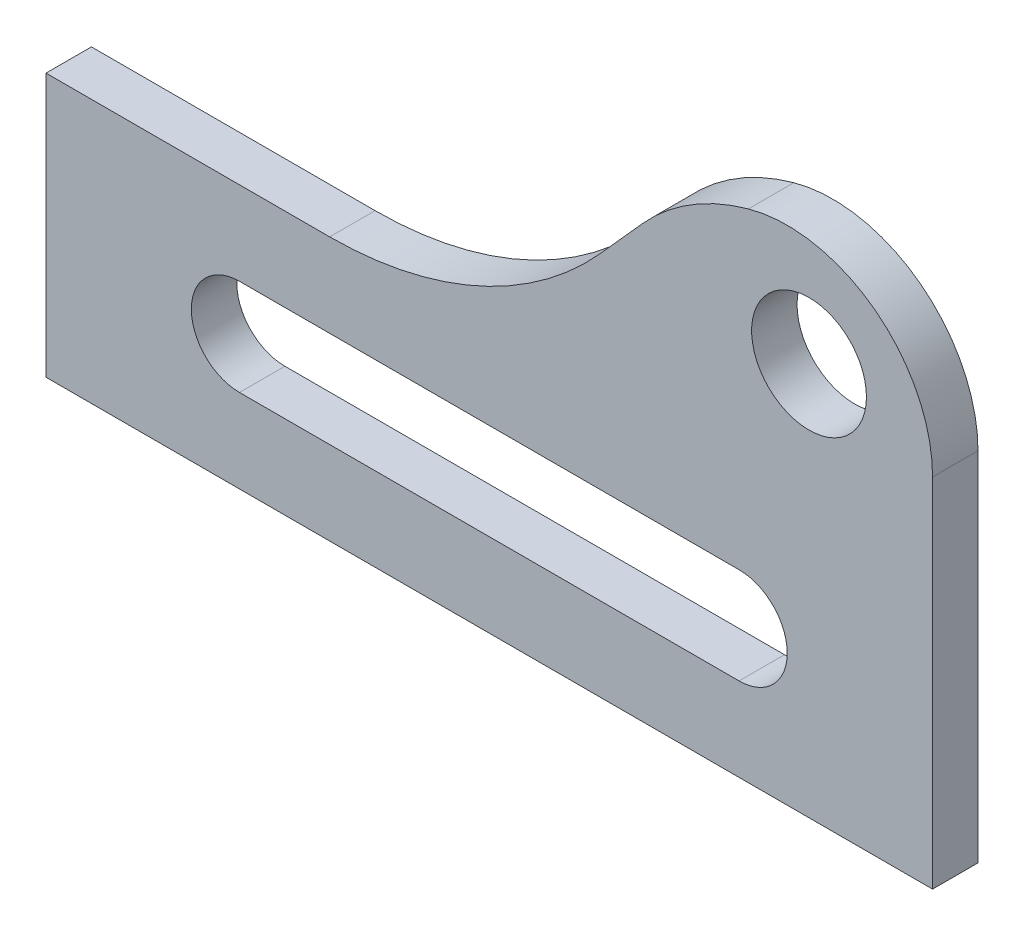
from build123d import *

# Parameters (mm, degrees)
SKETCH1_W           = 30.988
SKETCH1_H           = 9.2075
BOSS_EXTRUDE1_DEPTH = 1.5875
SKETCH2_R           = 2.0066
BOSS_EXTRUDE2_DEPTH = 1.5875
FILLET1_R           = 12.7
FILLET2_R           = 5.08
CUT_EXTRUDE1_DEPTH  = 36.65115735


with BuildPart() as part:
    # Sketch1 → Boss-Extrude1 (new body)
    with BuildSketch(Plane.XY):
        with Locations((15.494, 4.60375)):
            Rectangle(SKETCH1_W, SKETCH1_H)
    extrude(amount=BOSS_EXTRUDE1_DEPTH)

    # Sketch2 → Boss-Extrude2 (add)
    with BuildSketch(Plane.XY.offset(1.5875)):
        with BuildLine():
            Line((15.588120411, 9.2075), (30.988, 9.2075))
            Line((30.988, 9.2075), (30.988, 16.312421236))
            ThreePointArc((30.988, 16.312421236), (25.682747304, 17.596645629), (20.843386501, 15.071665335))
            Line((20.843386501, 15.071665335), (15.588120411, 9.2075))
        make_face()
        with Locations((26.67, 13.742344032)):
            Circle(SKETCH2_R, mode=Mode.SUBTRACT)
    extrude(amount=-BOSS_EXTRUDE2_DEPTH)

    # Fillet1
    fillet1_edges = [part.edges().sort_by_distance(p)[0] for p in [
        (15.588120411, 9.2075, 0.79375),
    ]]
    fillet(fillet1_edges, radius=FILLET1_R)

    # Fillet2
    fillet2_edges = [part.edges().sort_by_distance(p)[0] for p in [
        (30.988, 16.312421236, 0.79375),
    ]]
    fillet(fillet2_edges, radius=FILLET2_R)

    # Sketch3 → Cut-Extrude1 (cut, through all)
    with BuildSketch(Plane.XY.offset(1.5875)):
        with BuildLine():
            Line((6.76275, 6.2865), (24.22525, 6.2865))
            ThreePointArc((24.22525, 6.2865), (25.908, 4.60375), (24.22525, 2.921))
            Line((24.22525, 2.921), (6.76275, 2.921))
            ThreePointArc((6.76275, 2.921), (5.08, 4.60375), (6.76275, 6.2865))
        make_face()
    extrude(amount=-CUT_EXTRUDE1_DEPTH, mode=Mode.SUBTRACT)


solid = part.part
